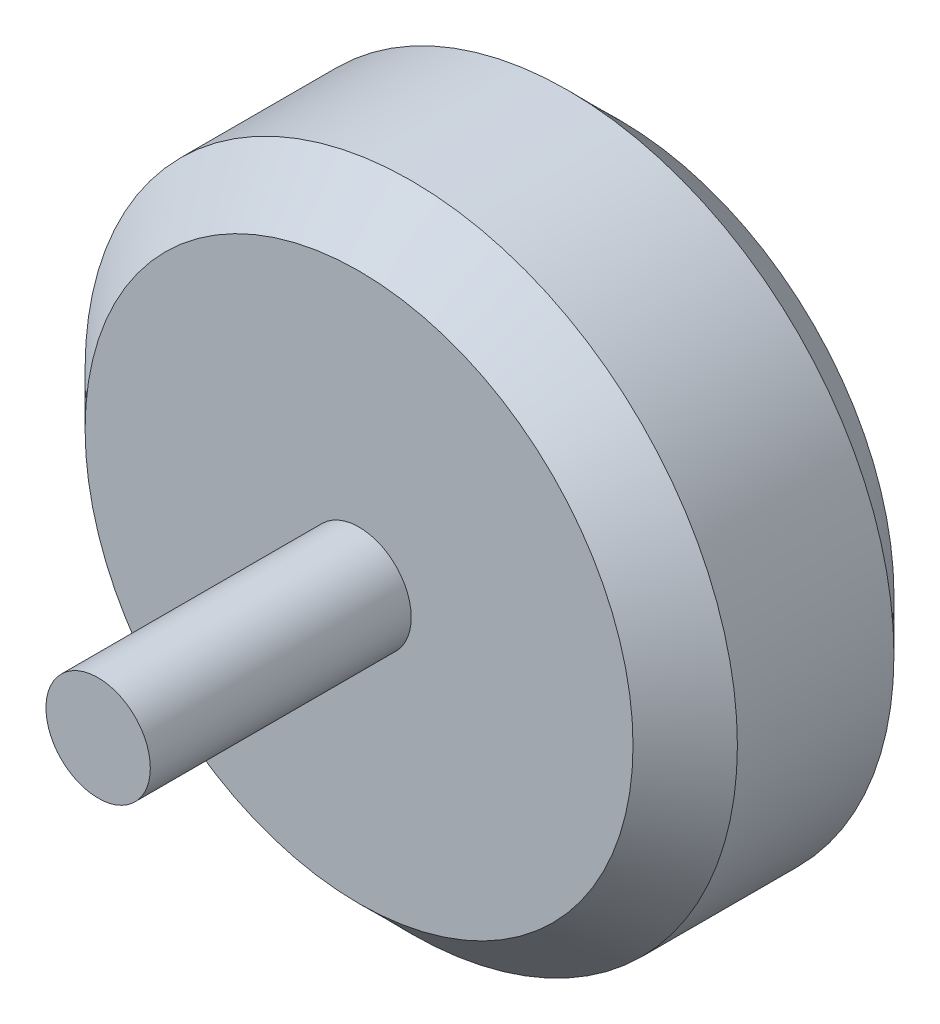
from build123d import *

# Parameters (mm, degrees)
SKETCH1_R           = 12.5
BOSS_EXTRUDE1_DEPTH = 5
CHAMFER1_SIZE       = 2
SKETCH2_R           = 2
BOSS_EXTRUDE2_DEPTH = 10


with BuildPart() as part:
    # Sketch1 → Boss-Extrude1 (new, symmetric)
    with BuildSketch(Plane.XY):
        with Locations((-55.110705908, 20.7)):
            Circle(SKETCH1_R)
    extrude(amount=BOSS_EXTRUDE1_DEPTH, both=True)

    # Chamfer1
    chamfer1_edges = [part.edges().sort_by_distance(p)[0] for p in [
        (-67.610705908, 20.7, -5),
        (-67.610705908, 20.7, 5),
    ]]
    chamfer(chamfer1_edges, length=CHAMFER1_SIZE)

    # Sketch2 → Boss-Extrude2 (add)
    with BuildSketch(Plane.XY.offset(5)):
        with Locations((-55.110705908, 20.7)):
            Circle(SKETCH2_R)
    extrude(amount=BOSS_EXTRUDE2_DEPTH)


solid = part.part
